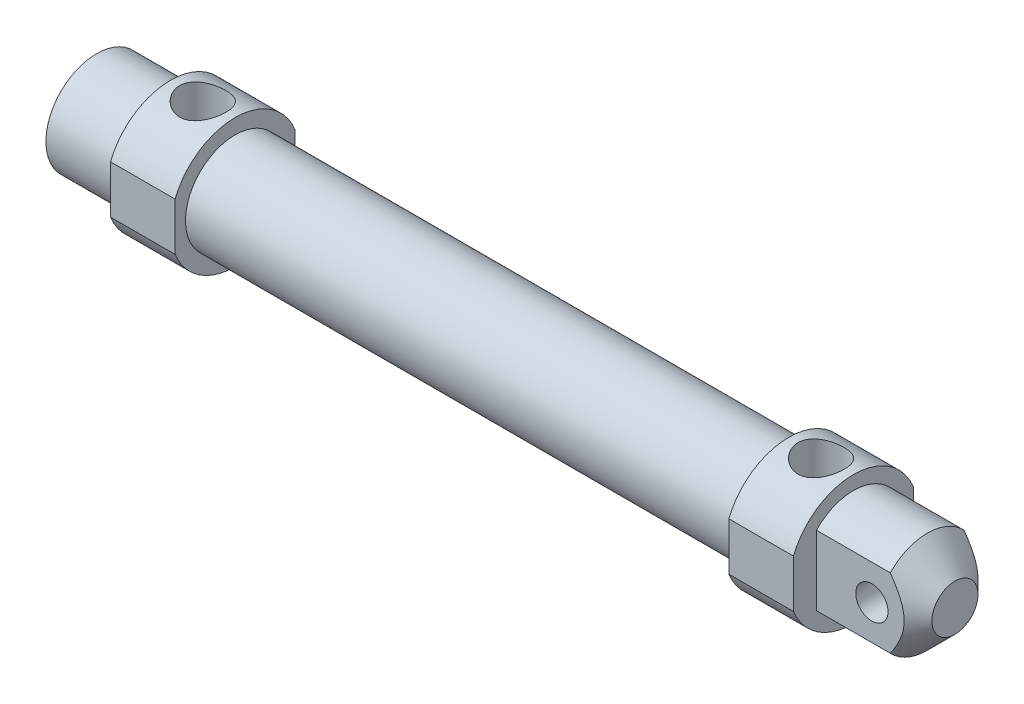
from build123d import *

# Parameters (mm, degrees)
SKETCH_2_R          = 11
EXTRUDE_1_DEPTH     = 16
EXTRUDE_2_DEPTH     = 14
SKETCH_5_R          = 10.75
EXTRUDE_3_DEPTH     = 120
EXTRUDE_4_DEPTH     = 14
SKETCH_7_R          = 8
CUT_EXTRUDE_1_DEPTH = 3
SKETCH_8_R          = 4
CUT_EXTRUDE_2_DEPTH = 100
SKETCH_9_R          = 5
CUT_EXTRUDE_3_DEPTH = 15
SKETCH_10_R         = 11
EXTRUDE_5_DEPTH     = 22
CHAMFER_1_SIZE      = 6
CUT_EXTRUDE_START   = -22
CUT_EXTRUDE_4_DEPTH = 22
SKETCH_12_R         = 3.5
CUT_EXTRUDE_5_DEPTH = 188.704555105


with BuildPart() as part:
    # ｽｹｯﾁ2 → ﾎﾞｽ - 押し出し1 (new body)
    with BuildSketch(Plane(origin=(0, 0, 0), x_dir=(0, 0, -1), z_dir=(1, 0, 0))):
        Circle(SKETCH_2_R)
    extrude(amount=EXTRUDE_1_DEPTH)

    # ｽｹｯﾁ4 → ﾎﾞｽ - 押し出し2 (add)
    with BuildSketch(Plane(origin=(16, 0, 0), x_dir=(0, 0, -1), z_dir=(1, 0, 0))):
        with BuildLine():
            Line((13, -5.196152423), (13, 5.196152423))
            Line((13, 5.196152423), (9.695359715, 5.196152423))
            ThreePointArc((9.695359715, 5.196152423), (10.668855535, 2.678716403), (11, 0))
            ThreePointArc((11, 0), (10.668855535, -2.678716403), (9.695359715, -5.196152423))
            Line((9.695359715, -5.196152423), (13, -5.196152423))
        make_face()
        with BuildLine():
            Line((9.695359715, 5.196152423), (-9.695359715, 5.196152423))
            ThreePointArc((-9.695359715, 5.196152423), (-11, 0), (-9.695359715, -5.196152423))
            Line((-9.695359715, -5.196152423), (9.695359715, -5.196152423))
            ThreePointArc((9.695359715, -5.196152423), (10.668855535, -2.678716403), (11, 0))
            ThreePointArc((11, 0), (10.668855535, 2.678716403), (9.695359715, 5.196152423))
        make_face()
        with BuildLine():
            Line((-9.695359715, 5.196152423), (-13, 5.196152423))
            Line((-13, 5.196152423), (-13, -5.196152423))
            Line((-13, -5.196152423), (-9.695359715, -5.196152423))
            ThreePointArc((-9.695359715, -5.196152423), (-11, 0), (-9.695359715, 5.196152423))
        make_face()
        with BuildLine():
            ThreePointArc((13, 5.196152423), (0, 14), (-13, 5.196152423))
            Line((-13, 5.196152423), (-9.695359715, 5.196152423))
            ThreePointArc((-9.695359715, 5.196152423), (0, 11), (9.695359715, 5.196152423))
            Line((9.695359715, 5.196152423), (13, 5.196152423))
        make_face()
        with BuildLine():
            ThreePointArc((9.695359715, 5.196152423), (0, 11), (-9.695359715, 5.196152423))
            Line((-9.695359715, 5.196152423), (9.695359715, 5.196152423))
        make_face()
        with BuildLine():
            Line((9.695359715, -5.196152423), (-9.695359715, -5.196152423))
            ThreePointArc((-9.695359715, -5.196152423), (0, -11), (9.695359715, -5.196152423))
        make_face()
        with BuildLine():
            Line((-9.695359715, -5.196152423), (-13, -5.196152423))
            ThreePointArc((-13, -5.196152423), (0, -14), (13, -5.196152423))
            Line((13, -5.196152423), (9.695359715, -5.196152423))
            ThreePointArc((9.695359715, -5.196152423), (0, -11), (-9.695359715, -5.196152423))
        make_face()
    extrude(amount=EXTRUDE_2_DEPTH)

    # ｽｹｯﾁ5 → ﾎﾞｽ - 押し出し3 (add)
    with BuildSketch(Plane(origin=(30, 0, 0), x_dir=(0, 0, -1), z_dir=(1, 0, 0))):
        Circle(SKETCH_5_R)
    extrude(amount=EXTRUDE_3_DEPTH)

    # ｽｹｯﾁ6 → ﾎﾞｽ - 押し出し4 (add)
    with BuildSketch(Plane(origin=(150, 0, 0), x_dir=(0, 0, -1), z_dir=(1, 0, 0))):
        with BuildLine():
            ThreePointArc((9.410765112, 5.196152423), (0, 10.75), (-9.410765112, 5.196152423))
            Line((-9.410765112, 5.196152423), (9.410765112, 5.196152423))
        make_face()
        with BuildLine():
            ThreePointArc((13, 5.196152423), (0, 14), (-13, 5.196152423))
            Line((-13, 5.196152423), (-9.410765112, 5.196152423))
            ThreePointArc((-9.410765112, 5.196152423), (0, 10.75), (9.410765112, 5.196152423))
            Line((9.410765112, 5.196152423), (13, 5.196152423))
        make_face()
        with BuildLine():
            ThreePointArc((-9.410765112, 5.196152423), (-10.75, 0), (-9.410765112, -5.196152423))
            Line((-9.410765112, -5.196152423), (9.410765112, -5.196152423))
            ThreePointArc((9.410765112, -5.196152423), (10.409808475, -2.682981088), (10.75, 0))
            ThreePointArc((10.75, 0), (10.409808475, 2.682981088), (9.410765112, 5.196152423))
            Line((9.410765112, 5.196152423), (-9.410765112, 5.196152423))
        make_face()
        with BuildLine():
            Line((9.410765112, -5.196152423), (13, -5.196152423))
            Line((13, -5.196152423), (13, 5.196152423))
            Line((13, 5.196152423), (9.410765112, 5.196152423))
            ThreePointArc((9.410765112, 5.196152423), (10.409808475, 2.682981088), (10.75, 0))
            ThreePointArc((10.75, 0), (10.409808475, -2.682981088), (9.410765112, -5.196152423))
        make_face()
        with BuildLine():
            Line((-13, 5.196152423), (-13, -5.196152423))
            Line((-13, -5.196152423), (-9.410765112, -5.196152423))
            ThreePointArc((-9.410765112, -5.196152423), (-10.75, 0), (-9.410765112, 5.196152423))
            Line((-9.410765112, 5.196152423), (-13, 5.196152423))
        make_face()
        with BuildLine():
            Line((9.410765112, -5.196152423), (-9.410765112, -5.196152423))
            ThreePointArc((-9.410765112, -5.196152423), (0, -10.75), (9.410765112, -5.196152423))
        make_face()
        with BuildLine():
            Line((-9.410765112, -5.196152423), (-13, -5.196152423))
            ThreePointArc((-13, -5.196152423), (0, -14), (13, -5.196152423))
            Line((13, -5.196152423), (9.410765112, -5.196152423))
            ThreePointArc((9.410765112, -5.196152423), (0, -10.75), (-9.410765112, -5.196152423))
        make_face()
    extrude(amount=EXTRUDE_4_DEPTH)

    # ｽｹｯﾁ7 → ｶｯﾄ - 押し出し1 (cut)
    with BuildSketch(Plane.ZY):
        Circle(SKETCH_7_R)
    extrude(amount=-CUT_EXTRUDE_1_DEPTH, mode=Mode.SUBTRACT)

    # ｽｹｯﾁ8 → ｶｯﾄ - 押し出し2 (cut)
    with BuildSketch(Plane.ZY.offset(-3)):
        Circle(SKETCH_8_R)
    extrude(amount=-CUT_EXTRUDE_2_DEPTH, mode=Mode.SUBTRACT)

    # ｽｹｯﾁ9 → ｶｯﾄ - 押し出し3 (cut)
    with BuildSketch(Plane(origin=(0, 20, 0), x_dir=(1, 0, 0), z_dir=(0, 1, 0))):
        with Locations(Location((23, 0, 0), (0, 0, 270))):
            Circle(SKETCH_9_R)
        with Locations(Location((157, 0, 0), (0, 0, 270))):
            Circle(SKETCH_9_R)
    extrude(amount=-CUT_EXTRUDE_3_DEPTH, mode=Mode.SUBTRACT)

    # ｽｹｯﾁ10 → ﾎﾞｽ - 押し出し5 (add)
    with BuildSketch(Plane(origin=(164, 0, 0), x_dir=(0, 0, -1), z_dir=(1, 0, 0))):
        Circle(SKETCH_10_R)
    extrude(amount=EXTRUDE_5_DEPTH)

    # 面取り1
    chamfer_1_edges = [part.edges().sort_by_distance(p)[0] for p in [
        (186, 0, 11),
    ]]
    chamfer(chamfer_1_edges, length=CHAMFER_1_SIZE)

    # ｽｹｯﾁ11 → ｶｯﾄ - 押し出し4 (cut)
    with BuildSketch(Plane(origin=(186, 0, 0), x_dir=(0, 0, -1), z_dir=(1, 0, 0)).offset(CUT_EXTRUDE_START)):
        with BuildLine():
            ThreePointArc((-8, 7.549834435), (-11, 0), (-8, -7.549834435))
            Line((-8, -7.549834435), (-8, 7.549834435))
        make_face()
        with BuildLine():
            Line((8, 7.549834435), (8, -7.549834435))
            ThreePointArc((8, -7.549834435), (10.22252415, -4.062019202), (11, 0))
            ThreePointArc((11, 0), (10.22252415, 4.062019202), (8, 7.549834435))
        make_face()
    extrude(amount=CUT_EXTRUDE_4_DEPTH, mode=Mode.SUBTRACT)

    # ｽｹｯﾁ12 → ｶｯﾄ - 押し出し5 (cut, through all)
    with BuildSketch(Plane.XY.offset(8)):
        with Locations((176, 0)):
            Circle(SKETCH_12_R)
    extrude(amount=-CUT_EXTRUDE_5_DEPTH, mode=Mode.SUBTRACT)


solid = part.part
